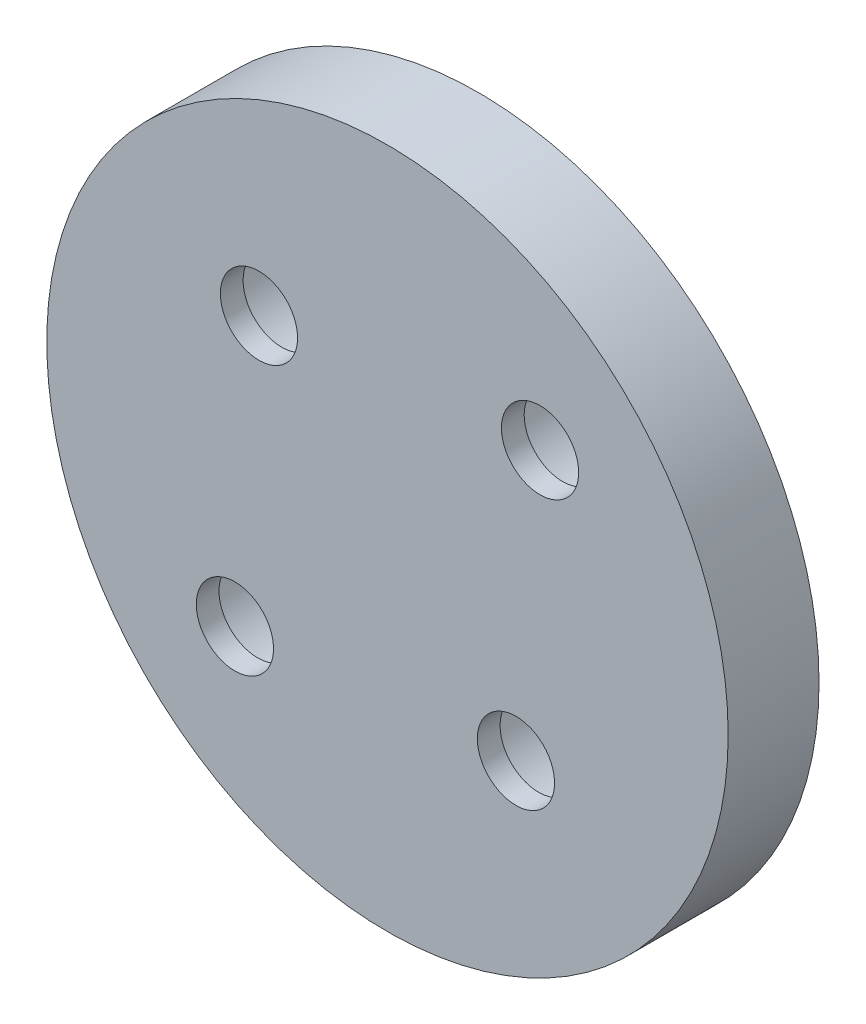
from build123d import *

# Parameters (mm, degrees)
SKETCH1_R           = 15
BOSS_EXTRUDE1_DEPTH = 4
SKETCH2_R           = 3.25
CUT_EXTRUDE1_DEPTH  = 3
SKETCH3_R           = 1.7
CUT_EXTRUDE2_DEPTH  = 22.587033145
SKETCH4_R           = 2
CUT_EXTRUDE3_DEPTH  = 2
SKETCH5_W           = 3
SKETCH5_H           = 15
BOSS_EXTRUDE2_DEPTH = 2
SKETCH7_W           = 1
SKETCH7_H           = 15
CUT_EXTRUDE4_DEPTH  = 1


with BuildPart() as part:
    # Sketch1 → Boss-Extrude1 (new body)
    with BuildSketch(Plane.XY):
        Circle(SKETCH1_R)
    extrude(amount=BOSS_EXTRUDE1_DEPTH)

    # Sketch2 → Cut-Extrude1 (cut)
    with BuildSketch(Plane(origin=(0, 0, 0), x_dir=(-1, 0, 0), z_dir=(0, 0, -1))):
        with Locations((-6.717514421, 6.717514421)):
            Circle(SKETCH2_R)
        with Locations((6.717514421, -6.717514421)):
            Circle(SKETCH2_R)
        with Locations((-5.656854249, -5.656854249)):
            Circle(SKETCH2_R)
        with Locations((5.656854249, 5.656854249)):
            Circle(SKETCH2_R)
    extrude(amount=-CUT_EXTRUDE1_DEPTH, mode=Mode.SUBTRACT)

    # Sketch3 → Cut-Extrude2 (cut, through all)
    with BuildSketch(Plane(origin=(0, 0, 0), x_dir=(-1, 0, 0), z_dir=(0, 0, -1))):
        with Locations((-6.717514421, 6.717514421)):
            Circle(SKETCH3_R)
        with Locations((5.656854249, 5.656854249)):
            Circle(SKETCH3_R)
        with Locations((6.717514421, -6.717514421)):
            Circle(SKETCH3_R)
        with Locations((-5.656854249, -5.656854249)):
            Circle(SKETCH3_R)
    extrude(amount=-CUT_EXTRUDE2_DEPTH, mode=Mode.SUBTRACT)

    # Sketch4 → Cut-Extrude3 (cut)
    with BuildSketch(Plane.XY.offset(3)):
        Circle(SKETCH4_R)
    extrude(amount=-CUT_EXTRUDE3_DEPTH, mode=Mode.SUBTRACT)

    # Sketch5 → Boss-Extrude2 (add)
    with BuildSketch(Plane.XY):
        Rectangle(SKETCH5_W, SKETCH5_H)
    extrude(amount=-BOSS_EXTRUDE2_DEPTH)

    # Sketch7 → Cut-Extrude4 (cut)
    with BuildSketch(Plane(origin=(0, 0, 0), x_dir=(-1, 0, 0), z_dir=(0, 0, -1))):
        with Locations((-1, 0)):
            Rectangle(SKETCH7_W, SKETCH7_H)
        with Locations((1, 0)):
            Rectangle(SKETCH7_W, SKETCH7_H)
    extrude(amount=CUT_EXTRUDE4_DEPTH, mode=Mode.SUBTRACT)


solid = part.part
